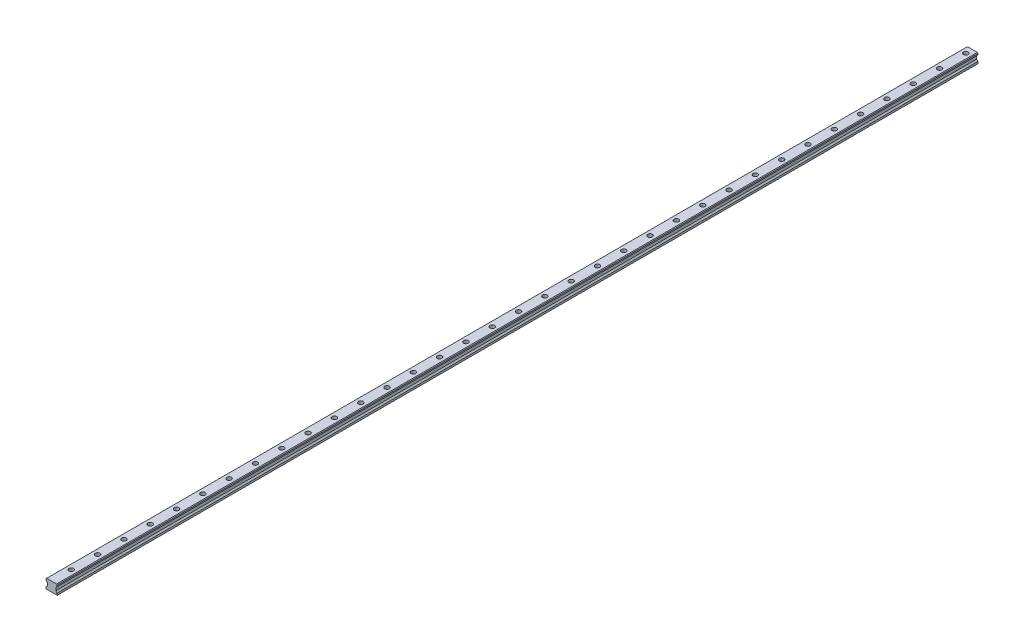
from build123d import *

# Parameters (mm, degrees)
EXTRUDE_1_DEPTH        = 2800
CHAMFER_1_SIZE         = 2
SKETCH_2_R             = 7
CUT_EXTRUDE_1_DEPTH    = 12
PATTERN_LINEAR_1_COUNT = 35
PATTERN_LINEAR_1_PITCH = 80
SKETCH_3_R             = 4.5
CUT_EXTRUDE_2_DEPTH    = 40
PATTERN_LINEAR_2_COUNT = 35
PATTERN_LINEAR_2_PITCH = 80


with BuildPart() as part:
    # 草图1 → 凸台-拉伸1 (new body)
    with BuildSketch(Plane.XY):
        Polygon((-17, 0), (17, 0), (17, 6), (13, 10), (13, 19), (17, 23), (17, 29), (-17, 29), (-17, 23), (-13, 19), (-13, 10), (-17, 6), align=None)
    extrude(amount=EXTRUDE_1_DEPTH)

    # 倒角1
    chamfer_1_edges = [part.edges().sort_by_distance(p)[0] for p in [
        (-17, 29, 1400),
        (17, 29, 1400),
    ]]
    chamfer(chamfer_1_edges, length=CHAMFER_1_SIZE)

    # 草图2 → 切除-拉伸1 (cut)
    with BuildSketch(Plane(origin=(0, 29, 0), x_dir=(1, 0, 0), z_dir=(0, 1, 0))):
        with Locations(Location((0, -20, 0), (0, 0, 270))):
            Circle(SKETCH_2_R)
    cut_extrude_1 = extrude(amount=-CUT_EXTRUDE_1_DEPTH, mode=Mode.SUBTRACT)

    # 阵列(线性)1: 切除-拉伸1 ×35
    with Locations(*[(0, 0, i * PATTERN_LINEAR_1_PITCH) for i in range(1, PATTERN_LINEAR_1_COUNT)]):
        add(cut_extrude_1, mode=Mode.SUBTRACT)

    # 草图3 → 切除-拉伸2 (cut)
    with BuildSketch(Plane(origin=(0, 29, 0), x_dir=(1, 0, 0), z_dir=(0, 1, 0))):
        with Locations(Location((0, -20, 0), (0, 0, 270))):
            Circle(SKETCH_3_R)
    cut_extrude_2 = extrude(amount=-CUT_EXTRUDE_2_DEPTH, mode=Mode.SUBTRACT)

    # 阵列(线性)2: 切除-拉伸2 ×35
    with Locations(*[(0, 0, i * PATTERN_LINEAR_2_PITCH) for i in range(1, PATTERN_LINEAR_2_COUNT)]):
        add(cut_extrude_2, mode=Mode.SUBTRACT)


solid = part.part
